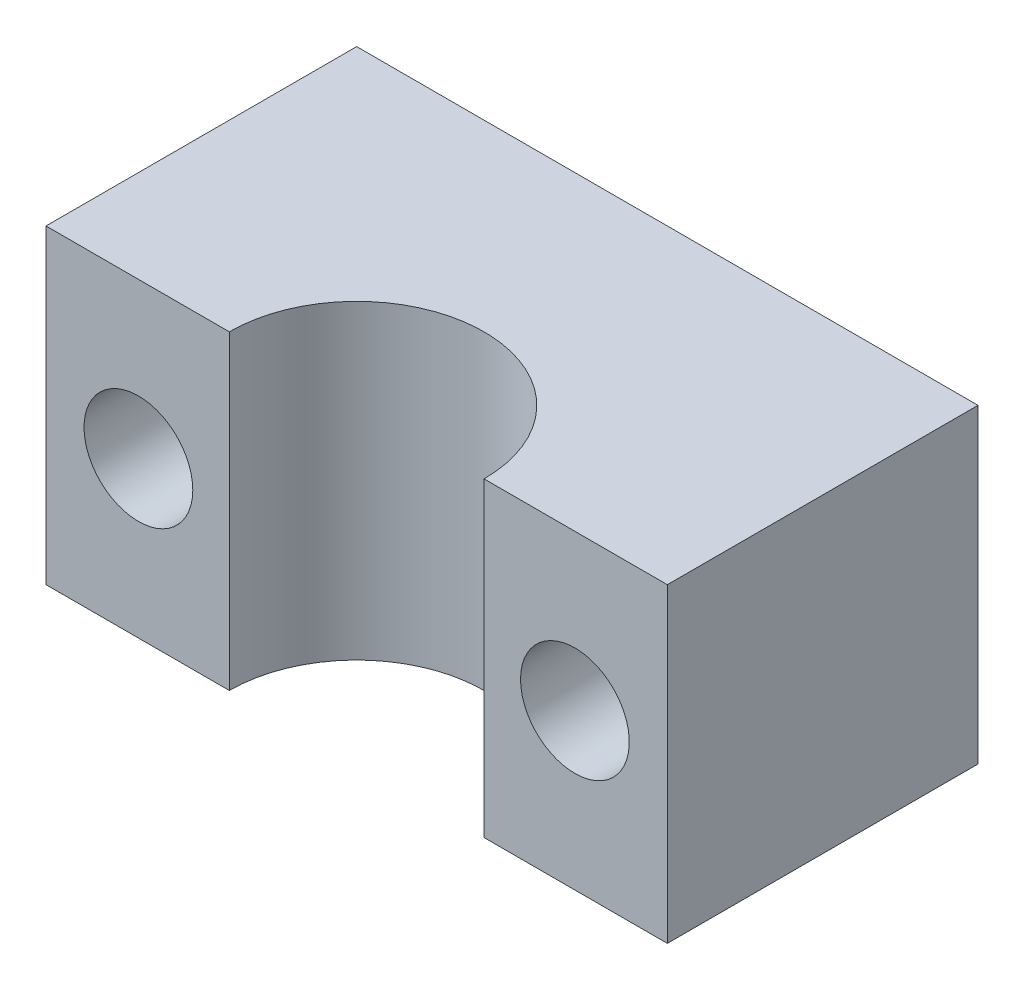
from build123d import *

# Parameters (mm, degrees)
CROQUIS1_W                = 5.9
CROQUIS1_H                = 10
CROQUIS1_R                = 1.75
SALIENTE_EXTRUIR1_DEPTH   = 10
SALIENTE_EXTRUIR1_2_DEPTH = 10
SALIENTE_EXTRUIR2_DEPTH   = 10


with BuildPart() as part:
    # Croquis1 → Saliente-Extruir1 (new body)
    with BuildSketch(Plane.XY):
        with Locations((-9.508333333, 2.425)):
            Rectangle(CROQUIS1_W, CROQUIS1_H)
        with Locations((-9.483333333, 2.425)):
            Circle(CROQUIS1_R, mode=Mode.SUBTRACT)
    extrude(amount=SALIENTE_EXTRUIR1_DEPTH)



with BuildPart() as body_2:
    # Croquis1 → Saliente-Extruir1 2 (new body)
    with BuildSketch(Plane.XY):
        with Locations((4.591666667, 2.425)):
            Rectangle(CROQUIS1_W, CROQUIS1_H)
        with Locations(Location((4.566666667, 2.425, 0), (0, 0, 180))):
            Circle(CROQUIS1_R, mode=Mode.SUBTRACT)
    extrude(amount=SALIENTE_EXTRUIR1_2_DEPTH)


with BuildPart() as part_1:
    add(part.part)

    add(body_2.part)  # Saliente-Extruir2 merges body 2
    # Croquis3 → Saliente-Extruir2 (add)
    with BuildSketch(Plane.XZ.offset(2.575)):
        with BuildLine():
            Line((-6.558333333, 10), (-6.558333333, 0))
            Line((-6.558333333, 0), (1.641666667, 0))
            Line((1.641666667, 0), (1.641666667, 10))
            ThreePointArc((1.641666667, 10), (-2.458333333, 5.9), (-6.558333333, 10))
        make_face()
    extrude(amount=-SALIENTE_EXTRUIR2_DEPTH)


solid = part_1.part
